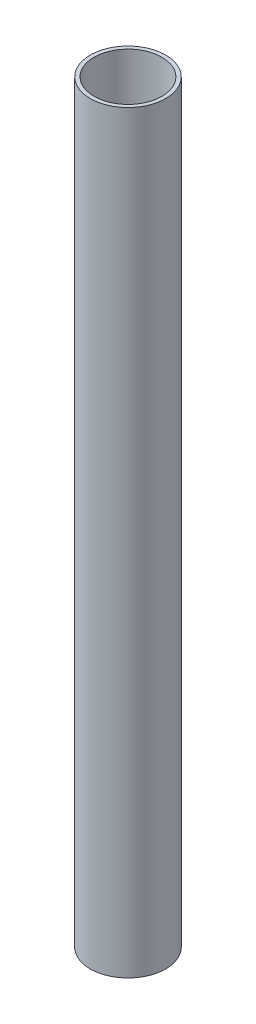
from build123d import *

# Parameters (mm, degrees)
SKETCH_1_R      = 10
SKETCH_1_R_2    = 9
EXTRUDE_1_DEPTH = 200


with BuildPart() as part:
    # 草图1 → 凸台-拉伸1 (new body)
    with BuildSketch(Plane(origin=(0, 0, 0), x_dir=(1, 0, 0), z_dir=(0, 1, 0))):
        with Locations(Location((0, 0, 0), (0, 0, 270))):
            Circle(SKETCH_1_R)
        with Locations(Location((0, 0, 0), (0, 0, 270))):
            Circle(SKETCH_1_R_2, mode=Mode.SUBTRACT)
    extrude(amount=EXTRUDE_1_DEPTH)


solid = part.part
